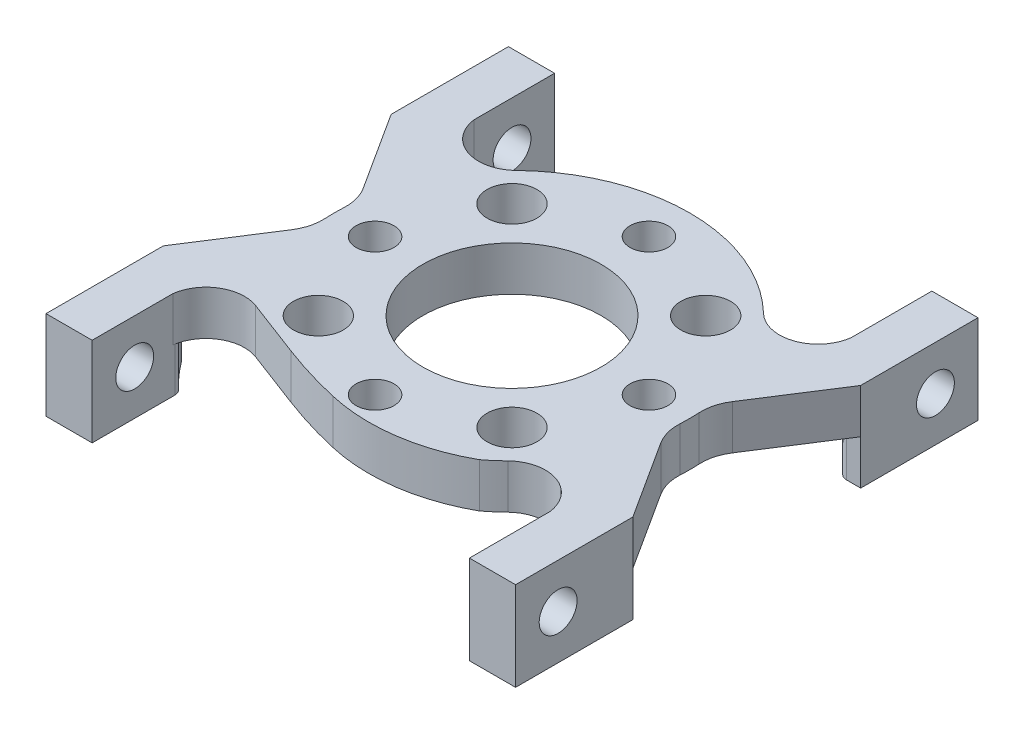
from build123d import *

# Parameters (mm, degrees)
SKETCH1_W                  = 33.528
SKETCH1_H                  = 33.02
BOSS_EXTRUDE1_DEPTH        = 3.175
CUT_EXTRUDE1_DEPTH         = 24.742207585
SKETCH3_W                  = 3.29438
SKETCH3_H                  = 8.37692
BOSS_EXTRUDE2_DEPTH        = 3.175
CUT_EXTRUDE2_DEPTH         = 25.370767243
SKETCH5_W                  = 3.29438
SKETCH5_H                  = 8.37692
BOSS_EXTRUDE3_DEPTH        = 3.175
CUT_EXTRUDE3_DEPTH         = 25.370767243
SKETCH7_W                  = 3.29438
SKETCH7_H                  = 8.37692
BOSS_EXTRUDE4_DEPTH        = 3.175
CUT_EXTRUDE4_DEPTH         = 25.370767243
SKETCH9_W                  = 3.29438
SKETCH9_H                  = 8.37692
BOSS_EXTRUDE5_DEPTH        = 3.175
CUT_EXTRUDE5_DEPTH         = 3.175
CUT_EXTRUDE6_DEPTH         = 3.175
CUT_EXTRUDE7_DEPTH         = 3.175
CUT_EXTRUDE8_DEPTH         = 3.175
HOLE1_D                    = 12.7254
M2_5_CLEARANCE_HOLE1_D     = 2.7051
M3_CLEARANCE_HOLE1_D       = 3.556
M2_5_CLEARANCE_HOLE2_D     = 2.7051
M2_5_CLEARANCE_HOLE2_DEPTH = 3.29438
M2_5_CLEARANCE_HOLE3_D     = 2.7051
M2_5_CLEARANCE_HOLE3_DEPTH = 3.29438
M2_5_CLEARANCE_HOLE4_D     = 2.7051
M2_5_CLEARANCE_HOLE4_DEPTH = 3.29443
FILLET1_R                  = 0.635
FILLET2_R                  = 3.175
CUT_EXTRUDE9_REACH         = 25.742
CUT_EXTRUDE12_REACH        = 29.049
SKETCH30_W                 = 14.449204344
SKETCH30_H                 = 9.791237154


with BuildPart() as part:
    # Sketch1 → Boss-Extrude1 (new body)
    with BuildSketch(Plane.XZ):
        Rectangle(SKETCH1_W, SKETCH1_H)
    extrude(amount=-BOSS_EXTRUDE1_DEPTH)

    # Sketch2 → Cut-Extrude1 (cut, through all)
    with BuildSketch(Plane(origin=(0, 3.175, 0), x_dir=(-1, 0, 0), z_dir=(0, 1, 0))):
        with BuildLine():
            Line((-13.46962, 16.51), (-13.46962, 10.753335779))
            ThreePointArc((-13.46962, 10.753335779), (-11.652039651, 8.508623021), (-8.8307675, 9.127296717))
            ThreePointArc((-8.8307675, 9.127296717), (0, 12.7), (8.8307675, 9.127296717))
            ThreePointArc((8.8307675, 9.127296717), (11.652039651, 8.508623021), (13.46962, 10.753335779))
            Line((13.46962, 10.753335779), (13.46962, 16.51))
            Line((13.46962, 16.51), (-13.46962, 16.51))
        make_face()
    extrude(amount=-CUT_EXTRUDE1_DEPTH, mode=Mode.SUBTRACT)

    # Sketch3 → Boss-Extrude2 (add)
    with BuildSketch(Plane.XZ):
        with Locations((-15.11681, 12.32154)):
            Rectangle(SKETCH3_W, SKETCH3_H)
    extrude(amount=BOSS_EXTRUDE2_DEPTH)

    # Sketch4 → Cut-Extrude2 (cut, through all)
    with BuildSketch(Plane(origin=(0, 3.175, 0), x_dir=(-1, 0, 0), z_dir=(0, 1, 0))):
        with BuildLine():
            Line((-16.764, 8.13308), (-16.764, -8.13308))
            Line((-16.764, -8.13308), (-12.593680427, -1.639882101))
            ThreePointArc((-12.593680427, -1.639882101), (-12.7, 0), (-12.593680427, 1.639882101))
            Line((-12.593680427, 1.639882101), (-16.764, 8.13308))
        make_face()
    extrude(amount=-CUT_EXTRUDE2_DEPTH, mode=Mode.SUBTRACT)

    # Sketch5 → Boss-Extrude3 (add)
    with BuildSketch(Plane.XZ):
        with Locations((15.11681, 12.32154)):
            Rectangle(SKETCH5_W, SKETCH5_H)
    extrude(amount=BOSS_EXTRUDE3_DEPTH)

    # Sketch6 → Cut-Extrude3 (cut, through all)
    with BuildSketch(Plane(origin=(0, 3.175, 0), x_dir=(-1, 0, 0), z_dir=(0, 1, 0))):
        with BuildLine():
            Line((13.46962, -16.51), (13.46962, -10.753335779))
            ThreePointArc((13.46962, -10.753335779), (11.652039651, -8.508623021), (8.8307675, -9.127296717))
            ThreePointArc((8.8307675, -9.127296717), (0, -12.7), (-8.8307675, -9.127296717))
            ThreePointArc((-8.8307675, -9.127296717), (-11.652039651, -8.508623021), (-13.46962, -10.753335779))
            Line((-13.46962, -10.753335779), (-13.46962, -16.51))
            Line((-13.46962, -16.51), (13.46962, -16.51))
        make_face()
    extrude(amount=-CUT_EXTRUDE3_DEPTH, mode=Mode.SUBTRACT)

    # Sketch7 → Boss-Extrude4 (add)
    with BuildSketch(Plane.XZ):
        with Locations((15.11681, -12.32154)):
            Rectangle(SKETCH7_W, SKETCH7_H)
    extrude(amount=BOSS_EXTRUDE4_DEPTH)

    # Sketch8 → Cut-Extrude4 (cut, through all)
    with BuildSketch(Plane(origin=(0, 3.175, 0), x_dir=(-1, 0, 0), z_dir=(0, 1, 0))):
        with BuildLine():
            Line((16.764, -8.13308), (16.764, 8.13308))
            Line((16.764, 8.13308), (12.593680427, 1.639882101))
            ThreePointArc((12.593680427, 1.639882101), (12.7, 0), (12.593680427, -1.639882101))
            Line((12.593680427, -1.639882101), (16.764, -8.13308))
        make_face()
    extrude(amount=-CUT_EXTRUDE4_DEPTH, mode=Mode.SUBTRACT)

    # Sketch9 → Boss-Extrude5 (add)
    with BuildSketch(Plane.XZ):
        with Locations((-15.11681, -12.32154)):
            Rectangle(SKETCH9_W, SKETCH9_H)
    extrude(amount=BOSS_EXTRUDE5_DEPTH)

    # Sketch10 → Cut-Extrude5 (cut)
    with BuildSketch(Plane.XZ.offset(3.175)):
        with BuildLine():
            Line((15.422429016, -8.13308), (13.46962, -8.13308))
            Line((13.46962, -8.13308), (13.46962, -10.329337463))
            ThreePointArc((13.46962, -10.329337463), (14.503938678, -9.282703292), (15.422429016, -8.13308))
        make_face()
    extrude(amount=-CUT_EXTRUDE5_DEPTH, mode=Mode.SUBTRACT)

    # Sketch11 → Cut-Extrude6 (cut)
    with BuildSketch(Plane.XZ.offset(3.175)):
        with BuildLine():
            Line((13.46962, 10.329337463), (13.46962, 8.13308))
            Line((13.46962, 8.13308), (15.422429016, 8.13308))
            ThreePointArc((15.422429016, 8.13308), (14.503938678, 9.282703292), (13.46962, 10.329337463))
        make_face()
    extrude(amount=-CUT_EXTRUDE6_DEPTH, mode=Mode.SUBTRACT)

    # Sketch12 → Cut-Extrude7 (cut)
    with BuildSketch(Plane.XZ.offset(3.175)):
        with BuildLine():
            Line((-15.422429016, 8.13308), (-13.46962, 8.13308))
            Line((-13.46962, 8.13308), (-13.46962, 10.329337463))
            ThreePointArc((-13.46962, 10.329337463), (-14.503938678, 9.282703292), (-15.422429016, 8.13308))
        make_face()
    extrude(amount=-CUT_EXTRUDE7_DEPTH, mode=Mode.SUBTRACT)

    # Sketch13 → Cut-Extrude8 (cut)
    with BuildSketch(Plane.XZ.offset(3.175)):
        with BuildLine():
            Line((-13.46962, -10.329337463), (-13.46962, -8.13308))
            Line((-13.46962, -8.13308), (-15.422429016, -8.13308))
            ThreePointArc((-15.422429016, -8.13308), (-14.503938678, -9.282703292), (-13.46962, -10.329337463))
        make_face()
    extrude(amount=-CUT_EXTRUDE8_DEPTH, mode=Mode.SUBTRACT)

    # Hole1 (through all)
    with Locations(Plane(origin=(0, 0, 0), x_dir=(-1, 0, 0), z_dir=(0, -1, 0))):
        with Locations((0, 0)):
            Hole(HOLE1_D / 2)

    # M2.5 Clearance Hole1 (through all)
    with Locations(Plane(origin=(0, 0, 0), x_dir=(-1, 0, 0), z_dir=(0, -1, 0))):
        with Locations((0, -9.779), (9.779, 0), (0, 9.779), (-9.779, 0)):
            Hole(M2_5_CLEARANCE_HOLE1_D / 2)

    # M3 Clearance Hole1 (through all)
    with Locations(Plane(origin=(0, 0, 0), x_dir=(-1, 0, 0), z_dir=(0, -1, 0))):
        with Locations((6.914797213, -6.914797213), (6.914797213, 6.914797213), (-6.914797213, 6.914797213), (-6.914797213, -6.914797213)):
            Hole(M3_CLEARANCE_HOLE1_D / 2)

    # M2.5 Clearance Hole2
    with Locations(Plane(origin=(16.764, 0, 0), x_dir=(0, 0, -1), z_dir=(1, 0, 0))):
        with Locations((13.470384182, 0)):
            Hole(M2_5_CLEARANCE_HOLE2_D / 2, depth=M2_5_CLEARANCE_HOLE2_DEPTH)

    # M2.5 Clearance Hole3
    with Locations(Plane.ZY.offset(-13.46962)):
        with Locations((13.470384182, 0)):
            Hole(M2_5_CLEARANCE_HOLE3_D / 2, depth=M2_5_CLEARANCE_HOLE3_DEPTH)

    # M2.5 Clearance Hole4
    with Locations(Plane(origin=(-13.46962, 0, 0), x_dir=(0, 0, -1), z_dir=(1, 0, 0))):
        with Locations((-13.470384182, 0), (13.470384182, 0)):
            Hole(M2_5_CLEARANCE_HOLE4_D / 2, depth=M2_5_CLEARANCE_HOLE4_DEPTH)

    # Fillet1
    fillet1_edges = [part.edges().sort_by_distance(p)[0] for p in [
        (-13.46962, -1.5875, -10.329337463),
        (-15.422429016, -1.5875, 8.13308),
        (15.422429016, -1.5875, -8.13308),
        (15.422429016, -1.5875, 8.13308),
        (13.46962, -1.5875, -10.329337463),
        (-13.46962, -1.5875, 10.329337463),
        (-15.422429016, -1.5875, -8.13308),
        (13.46962, -1.5875, 10.329337463),
    ]]
    fillet(fillet1_edges, radius=FILLET1_R)

    # Fillet2
    fillet2_edges = [part.edges().sort_by_distance(p)[0] for p in [
        (-12.593680427, 1.5875, -1.639882101),
        (12.593680427, 1.5875, -1.639882101),
        (-12.593680427, 1.5875, 1.639882101),
        (12.593680427, 1.5875, 1.639882101),
    ]]
    fillet(fillet2_edges, radius=FILLET2_R)

    # Sketch26 → Cut-Extrude9 (cut, up to next)
    with BuildSketch(Plane.XZ, mode=Mode.PRIVATE) as cut_extrude9_sk1:
        with BuildLine():
            Line((-9.767427274, 8.532567661), (-5.711894532, 10.070912798))
            ThreePointArc((-5.711894532, 10.070912798), (-3.581292847, 10.796642581), (-1.406006336, 11.374808519))
            ThreePointArc((-1.406006336, 11.374808519), (3.286728936, 11.571725124), (7.737358426, 10.070912798))
            ThreePointArc((7.737358426, 10.070912798), (-0.72214173, 12.679452327), (-8.8307675, 9.127296717))
            ThreePointArc((-8.8307675, 9.127296717), (-9.268785679, 8.78219321), (-9.767427274, 8.532567661))
        make_face()
    cut_extrude9_tool1 = extrude(cut_extrude9_sk1.sketch, amount=-CUT_EXTRUDE9_REACH, mode=Mode.PRIVATE) & part.part
    add(cut_extrude9_tool1.solids().sort_by_distance((-1.945542, 0, 11.38762))[0], mode=Mode.SUBTRACT)

    # Sketch30 → Cut-Extrude12 (cut, up to next)
    with BuildSketch(Plane(origin=(0, -5.02784088, -3.068243182), x_dir=(-1, 0, 0), z_dir=(0, -0.853608474655993, -0.5209151293593509)), mode=Mode.PRIVATE) as cut_extrude12_sk1:
        with Locations((0.285206665, 14.086824926)):
            Rectangle(SKETCH30_W, SKETCH30_H)
    cut_extrude12_tool1 = extrude(cut_extrude12_sk1.sketch, amount=CUT_EXTRUDE12_REACH, mode=Mode.PRIVATE) & part.part
    add(cut_extrude12_tool1.solids().sort_by_distance((-0.285207, 2.310199, -15.092876))[0], mode=Mode.SUBTRACT)


solid = part.part
